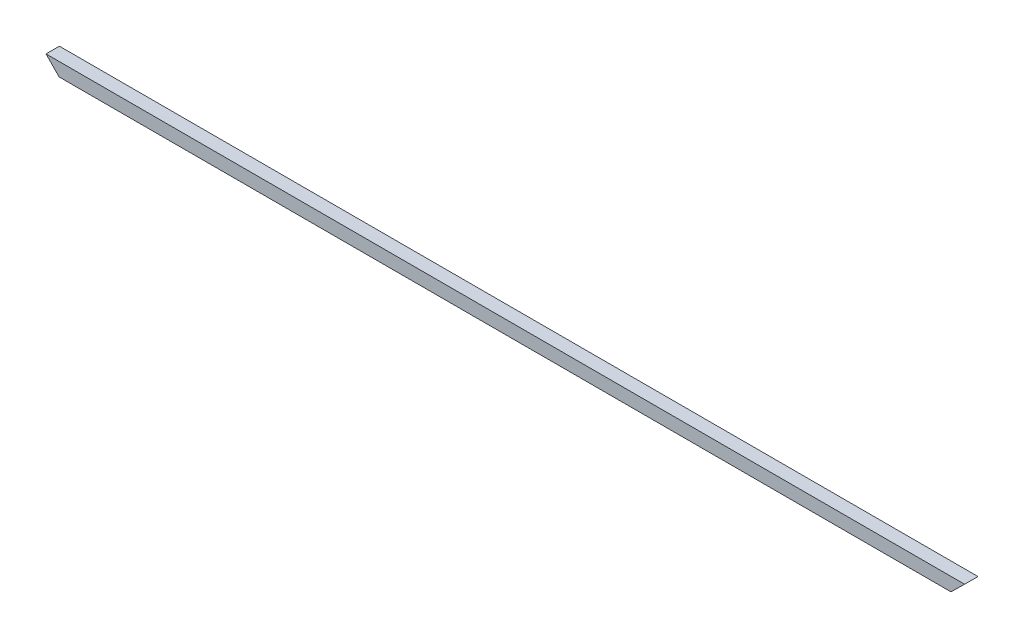
from build123d import *

# Parameters (mm, degrees)
BOSS_EXTRUDE1_DEPTH = 40


with BuildPart() as part:
    # Sketch2 → Boss-Extrude1 (new body)
    with BuildSketch(Plane.XY):
        Polygon((-2719.625176516, 0), (24.074823484, 0), (-16.771831658, -40), (-2680.454282487, -40), align=None)
    extrude(amount=BOSS_EXTRUDE1_DEPTH)


solid = part.part
